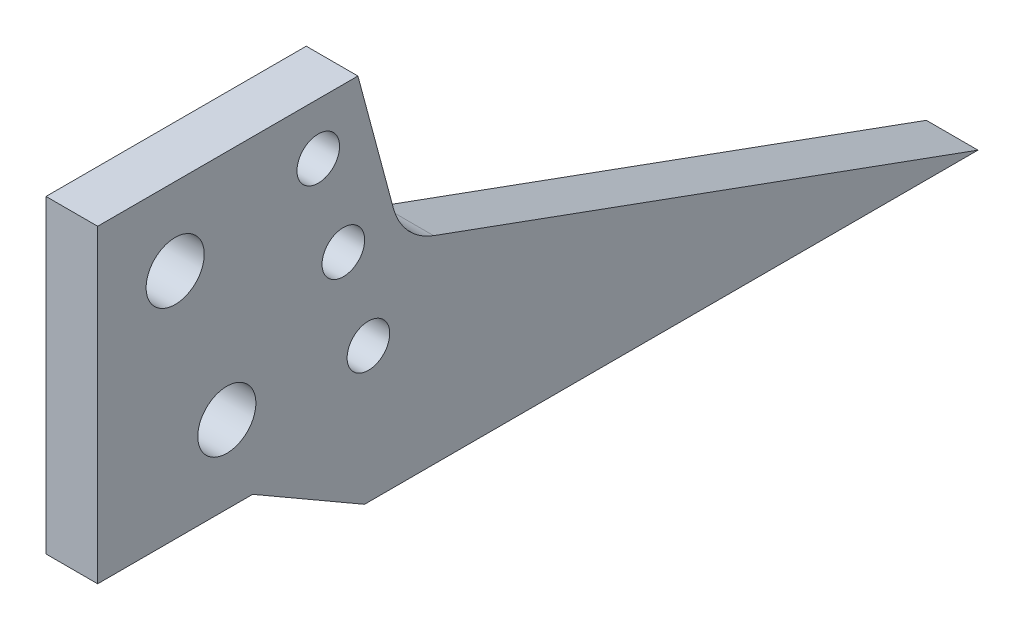
from build123d import *

# Parameters (mm, degrees)
RESSALTO_EXTRUS_O1_DEPTH = 8
ESBO_O2_W                = 32.3
ESBO_O2_H                = 16.047818473
CORTE_EXTRUS_O1_DEPTH    = 149.344709352
ESBO_O3_W                = 8
ESBO_O3_H                = 47.952181527
RESSALTO_EXTRUS_O2_DEPTH = 8
FURO_COM_FOLGA_DE_M81_D  = 9
FURO_COM_FOLGA_DE_M61_D  = 6.6
FILETE1_R                = 10


with BuildPart() as part:
    # Esboço1 → Ressalto-extrusão1 (new body)
    with BuildSketch(Plane(origin=(0, 0, 0), x_dir=(0, 0, -1), z_dir=(1, 0, 0))):
        Polygon((28, 74), (39.129876604, 32.462735031), (128.320508076, 0), (33.320508076, 0), (16, 10), (0, 10), (0, 74), align=None)
    extrude(amount=RESSALTO_EXTRUS_O1_DEPTH)

    # Esboço2 → Corte-extrusão1 (cut, through all)
    with BuildSketch(Plane(origin=(8, 0, 0), x_dir=(0, 0, -1), z_dir=(1, 0, 0))):
        with Locations((16.15, 65.976090763)):
            Rectangle(ESBO_O2_W, ESBO_O2_H)
    extrude(amount=-CORTE_EXTRUS_O1_DEPTH, mode=Mode.SUBTRACT)

    # Esboço3 → Ressalto-extrusão2 (add)
    with BuildSketch(Plane(origin=(8, 0, 0), x_dir=(0, 0, -1), z_dir=(1, 0, 0))):
        with Locations((-4, 33.976090763)):
            Rectangle(ESBO_O3_W, ESBO_O3_H)
    extrude(amount=-RESSALTO_EXTRUS_O2_DEPTH)

    # Furo com folga de M81 (through all)
    with Locations(Plane.ZY):
        with Locations((-4, 45.952181527), (-12, 22)):
            Hole(FURO_COM_FOLGA_DE_M81_D / 2)

    # Furo com folga de M61 (through all)
    with Locations(Plane(origin=(8, 0, 0), x_dir=(0, 0, -1), z_dir=(1, 0, 0))):
        with Locations((26.161384096, 49.952181527), (30.043669773, 35.463294133), (33.925955449, 20.974406739)):
            Hole(FURO_COM_FOLGA_DE_M61_D / 2)

    # Filete1
    filete1_edges = [part.edges().sort_by_distance(p)[0] for p in [
        (4, 32.462735031, -39.129876604),
    ]]
    fillet(filete1_edges, radius=FILETE1_R)


solid = part.part
